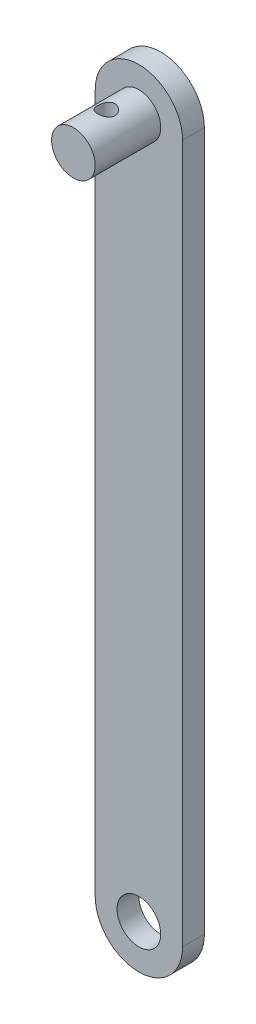
from build123d import *

# Parameters (mm, degrees)
SKETCH1_R           = 6.35
BOSS_EXTRUDE1_DEPTH = 6.35
SKETCH2_R           = 6.35
BOSS_EXTRUDE3_DEPTH = 25.4
SKETCH5_R           = 2.54
CUT_EXTRUDE2_DEPTH  = 118.774954893


with BuildPart() as part:
    # Sketch1 → Boss-Extrude1 (new body)
    with BuildSketch(Plane.XY):
        with BuildLine():
            Line((-12.7, -101.6), (-12.7, 101.6))
            ThreePointArc((-12.7, 101.6), (0, 114.3), (12.7, 101.6))
            Line((12.7, 101.6), (12.7, -101.6))
            ThreePointArc((12.7, -101.6), (0, -114.3), (-12.7, -101.6))
        make_face()
        with Locations((0, 101.6)):
            Circle(SKETCH1_R, mode=Mode.SUBTRACT)
        with Locations(Location((0, -101.6, 0), (0, 0, 180))):
            Circle(SKETCH1_R, mode=Mode.SUBTRACT)
    extrude(amount=BOSS_EXTRUDE1_DEPTH)

    # Sketch2 → Boss-Extrude3 (add)
    with BuildSketch(Plane.XY):
        with Locations((0, 101.6)):
            Circle(SKETCH2_R)
    extrude(amount=BOSS_EXTRUDE3_DEPTH)

    # Sketch5 → Cut-Extrude2 (cut, through all)
    with BuildSketch(Plane(origin=(0, 0, 0), x_dir=(1, 0, 0), z_dir=(0, 1, 0))):
        with Locations(Location((0, -15.875, 0), (0, 0, 90))):
            Circle(SKETCH5_R)
    extrude(amount=CUT_EXTRUDE2_DEPTH, mode=Mode.SUBTRACT)


solid = part.part
